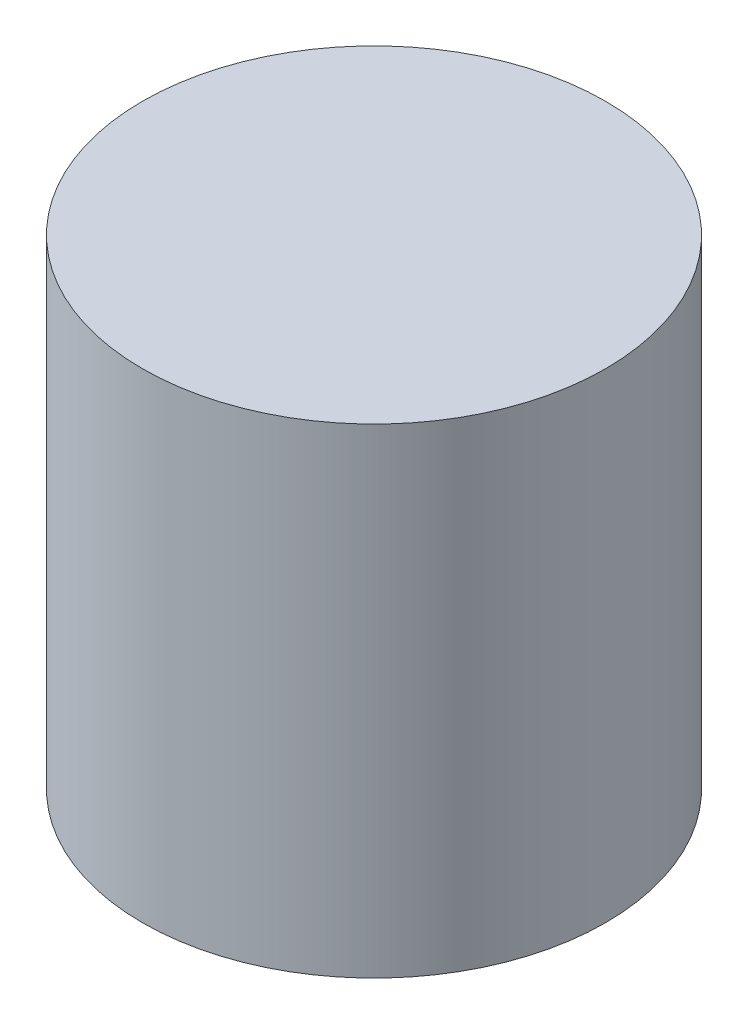
from build123d import *

# Parameters (mm, degrees)
SKETCH1_R           = 34.272438036
BOSS_EXTRUDE1_DEPTH = 71


with BuildPart() as part:
    # Sketch1 → Boss-Extrude1 (new body)
    with BuildSketch(Plane(origin=(0, 0, 0), x_dir=(1, 0, 0), z_dir=(0, 1, 0))):
        with Locations(Location((1.006192841, 0.701478064, 0), (0, 0, 270))):
            Circle(SKETCH1_R)
    extrude(amount=BOSS_EXTRUDE1_DEPTH)


solid = part.part
